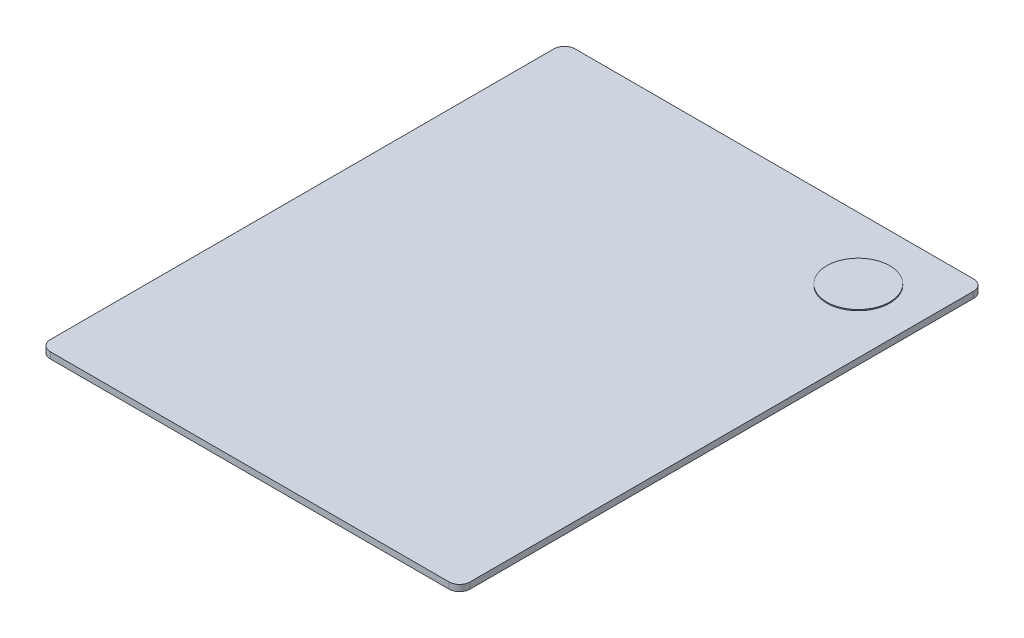
from build123d import *

# Parameters (mm, degrees)
SKETCH1_W           = 200
SKETCH1_H           = 250
BOSS_EXTRUDE1_DEPTH = 3
SKETCH2_R           = 15
BOSS_EXTRUDE6_DEPTH = 0.5
FILLET1_R           = 5


with BuildPart() as part:
    # Sketch1 → Boss-Extrude1 (new body)
    with BuildSketch(Plane(origin=(0, 0, 0), x_dir=(1, 0, 0), z_dir=(0, 1, 0))):
        Rectangle(SKETCH1_W, SKETCH1_H)
    extrude(amount=BOSS_EXTRUDE1_DEPTH)

    # Fillet1
    fillet1_edges = [part.edges().sort_by_distance(p)[0] for p in [
        (-100, 1.5, -125),
        (100, 1.5, -125),
        (100, 1.5, 125),
        (-100, 1.5, 125),
    ]]
    fillet(fillet1_edges, radius=FILLET1_R)


with BuildPart() as body_2:
    # Sketch2 → Boss-Extrude6 (new body)
    with BuildSketch(Plane(origin=(0, 3, 0), x_dir=(1, 0, 0), z_dir=(0, 1, 0))):
        with Locations(Location((70, 95, 0), (0, 0, 270))):
            Circle(SKETCH2_R)
    extrude(amount=BOSS_EXTRUDE6_DEPTH)


solid = Compound([part.part, body_2.part])
